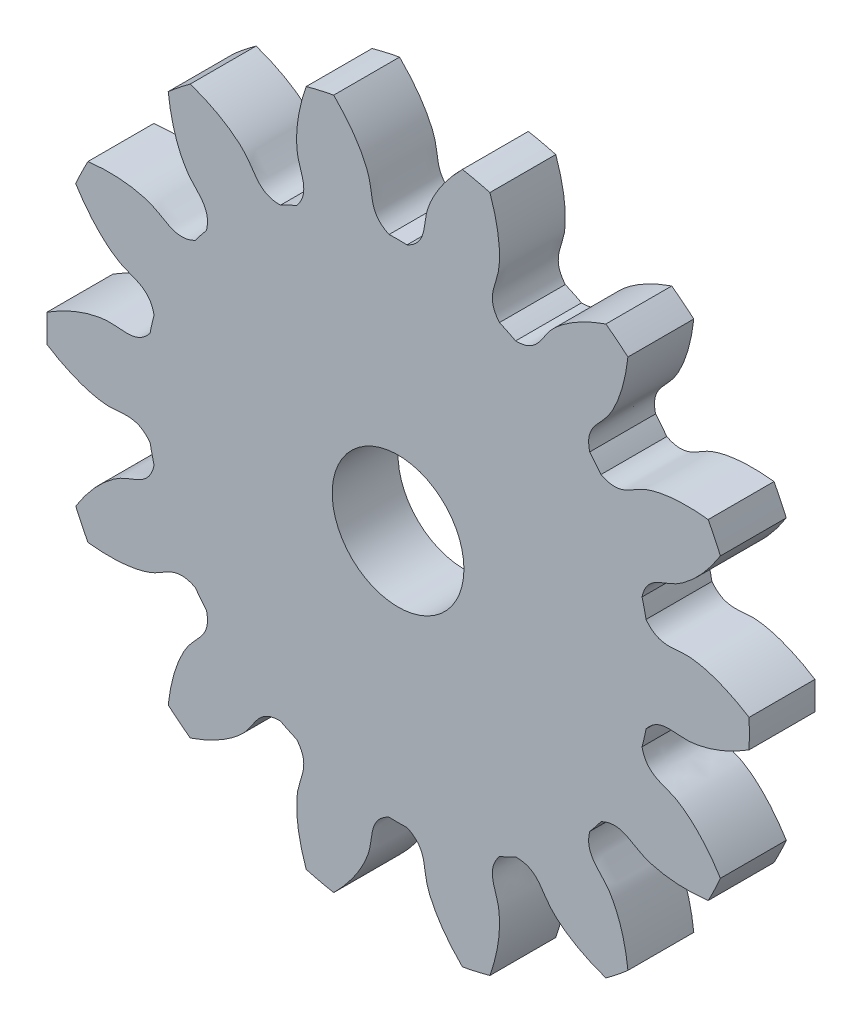
from build123d import *

# Parameters (mm, degrees)
SKETCH_1_R               = 16
EXTRUDE_1_DEPTH          = 1.5
CUT_EXTRUDE_1_DEPTH      = 23.677080941
PATTERN_CIRCULAR_1_COUNT = 14
SKETCH_4_R               = 3
CUT_EXTRUDE_2_DEPTH      = 5


with BuildPart() as part:
    # 草图1 → 凸台-拉伸1 (new, symmetric)
    with BuildSketch(Plane.XY):
        Circle(SKETCH_1_R)
    extrude(amount=EXTRUDE_1_DEPTH, both=True)

    # 草图2 → 切除-拉伸1 (cut, symmetric)
    with BuildSketch(Plane.XY):
        with BuildLine():
            ThreePointArc((0.4086286, 11.492737823), (0, 11.5), (-0.4086286, 11.492737823))
            add(Edge.make_bspline(
                [(-0.4086286, 11.492737823), (-1.293321386, 11.896045445), (-1.143497942, 12.634191281), (-1.327337875, 13.302818149), (-1.341537733, 13.350752938), (-1.358290158, 13.40340909), (-1.377784123, 13.460702686), (-1.400212654, 13.52254283), (-1.425764214, 13.588833181), (-1.454625152, 13.659471567), (-1.486978762, 13.734350198), (-1.523005362, 13.813355696), (-1.56288208, 13.896369187), (-1.606782724, 13.98326638), (-1.654877634, 14.073917655), (-1.707333536, 14.16818815), (-1.764313403, 14.265937856), (-1.825976316, 14.367021716), (-1.892477328, 14.471289722), (-1.963967328, 14.578587019), (-2.040592913, 14.688754016), (-2.122496256, 14.801626492), (-2.209814982, 14.917035712), (-2.302682046, 15.034808545), (-2.401225608, 15.154767579), (-2.50556892, 15.276731253), (-2.61583021, 15.400513972), (-2.732122572, 15.525926246), (-2.854553855, 15.652774817), (-2.983226561, 15.780862791), (-3.118237742, 15.909989781), (-3.259678903, 16.039952043), (-3.407635904, 16.17054262), (-3.562188874, 16.301551486), (-3.723412118, 16.432765693), (-3.891374036, 16.56396952), (-4.066137041, 16.694944627), (-4.247757483, 16.825470206), (-4.436285576, 16.955323136), (-4.631765328, 17.084278145), (-4.834234477, 17.212107964), (-5.043724427, 17.338583494), (-5.260260193, 17.463473962), (-5.483860353, 17.586547091), (-5.714536957, 17.707569268), (-6.034687281, 17.867451972), (-6.280747786, 17.981158872), (-6.447814907, 18.054421533)],
                knots=[0, 0, 0, 0, 0.215624359, 0.220482059, 0.225911253, 0.231911941, 0.238484123, 0.245627799, 0.253342969, 0.261629634, 0.270487792, 0.279917445, 0.289918591, 0.300491232, 0.311635367, 0.323350996, 0.335638119, 0.348496736, 0.361926847, 0.375928452, 0.390501552, 0.405646145, 0.421362233, 0.437649814, 0.45450889, 0.47193946, 0.489941524, 0.508515082, 0.527660134, 0.54737668, 0.56766472, 0.588524254, 0.609955283, 0.631957805, 0.654531822, 0.677677333, 0.701394337, 0.725682836, 0.750542829, 0.775974316, 0.801977297, 0.828551773, 0.855697742, 0.883415205, 0.911704163, 0.940564615, 1, 1, 1, 1], degree=3))
            ThreePointArc((-6.447814907, 18.054421533), (0, 19.171240283), (6.447814907, 18.054421533))
            add(Edge.make_bspline(
                [(0.4086286, 11.492737823), (1.293321386, 11.896045445), (1.143497942, 12.634191281), (1.327337875, 13.302818149), (1.341537733, 13.350752938), (1.358290158, 13.40340909), (1.377784123, 13.460702686), (1.400212654, 13.52254283), (1.425764214, 13.588833181), (1.454625152, 13.659471567), (1.486978762, 13.734350198), (1.523005362, 13.813355696), (1.56288208, 13.896369187), (1.606782724, 13.98326638), (1.654877634, 14.073917655), (1.707333536, 14.16818815), (1.764313403, 14.265937856), (1.825976316, 14.367021716), (1.892477328, 14.471289722), (1.963967328, 14.578587019), (2.040592913, 14.688754016), (2.122496256, 14.801626492), (2.209814982, 14.917035712), (2.302682046, 15.034808545), (2.401225608, 15.154767579), (2.50556892, 15.276731253), (2.61583021, 15.400513972), (2.732122572, 15.525926246), (2.854553855, 15.652774817), (2.983226561, 15.780862791), (3.118237742, 15.909989781), (3.259678903, 16.039952043), (3.407635904, 16.17054262), (3.562188874, 16.301551486), (3.723412118, 16.432765693), (3.891374036, 16.56396952), (4.066137041, 16.694944627), (4.247757483, 16.825470206), (4.436285576, 16.955323136), (4.631765328, 17.084278145), (4.834234477, 17.212107964), (5.043724427, 17.338583494), (5.260260193, 17.463473962), (5.483860353, 17.586547091), (5.714536957, 17.707569268), (6.034687281, 17.867451972), (6.280747786, 17.981158872), (6.447814907, 18.054421533)],
                knots=[0, 0, 0, 0, 0.215624359, 0.220482059, 0.225911253, 0.231911941, 0.238484123, 0.245627799, 0.253342969, 0.261629634, 0.270487792, 0.279917445, 0.289918591, 0.300491232, 0.311635367, 0.323350996, 0.335638119, 0.348496736, 0.361926847, 0.375928452, 0.390501552, 0.405646145, 0.421362233, 0.437649814, 0.45450889, 0.47193946, 0.489941524, 0.508515082, 0.527660134, 0.54737668, 0.56766472, 0.588524254, 0.609955283, 0.631957805, 0.654531822, 0.677677333, 0.701394337, 0.725682836, 0.750542829, 0.775974316, 0.801977297, 0.828551773, 0.855697742, 0.883415205, 0.911704163, 0.940564615, 1, 1, 1, 1], degree=3))
        make_face()
    cut_extrude_1 = extrude(amount=CUT_EXTRUDE_1_DEPTH, both=True, mode=Mode.SUBTRACT)

    # 阵列(圆周)1: 切除-拉伸1 ×14 about axis
    pattern_circular_1_axis = Axis((0, 0, -0.15), (0, 0, 1))
    for i in range(1, PATTERN_CIRCULAR_1_COUNT):
        add(cut_extrude_1.rotate(pattern_circular_1_axis, i * 360 / PATTERN_CIRCULAR_1_COUNT), mode=Mode.SUBTRACT)

    # 草图4 → 切除-拉伸2 (cut, symmetric)
    with BuildSketch(Plane.XY.offset(1.5)):
        Circle(SKETCH_4_R)
    extrude(amount=CUT_EXTRUDE_2_DEPTH, both=True, mode=Mode.SUBTRACT)


solid = part.part
